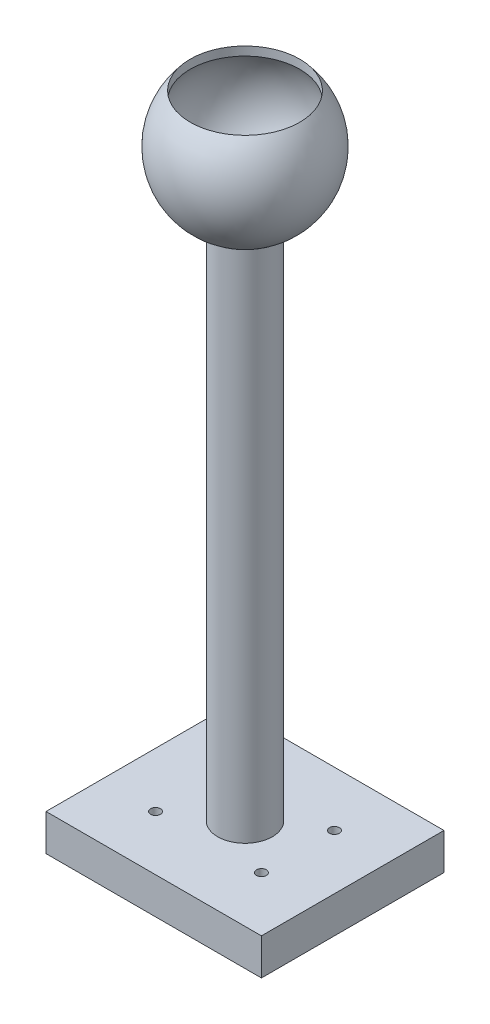
from build123d import *

# Parameters (mm, degrees)
CROQUIS1_W                       = 59
CROQUIS1_H                       = 50
SALIENTE_EXTRUIR1_50X50X24_DEPTH = 24
CROQUIS2_R                       = 7.5
SALIENTE_EXTRUIR2_15MM_DEPTH     = 160
CROQUIS8_R                       = 1.35
EXTRUIR_TORNILLOS_2_7MM_DEPTH    = 25
CROQUIS10_R                      = 15
EXTRUIR_ARRIBA_30_MM_DEPTH       = 29
CORTAR_EXTRUIR1_DEPTH            = 40
CORTAR_EXTRUIR1_DEPTH_BACK       = 40
F_184MM_W                        = 76.670543524
F_184MM_H                        = 14


with BuildPart() as part:
    # Croquis1 → Saliente-Extruir1 50X50X24 (new body)
    with BuildSketch(Plane(origin=(0, 0, 0), x_dir=(1, 0, 0), z_dir=(0, 1, 0))):
        Rectangle(CROQUIS1_W, CROQUIS1_H)
    extrude(amount=SALIENTE_EXTRUIR1_50X50X24_DEPTH)

    # Croquis2 → Saliente-Extruir2 15MM (add)
    with BuildSketch(Plane(origin=(0, 24, 0), x_dir=(1, 0, 0), z_dir=(0, 1, 0))):
        with Locations(Location((0, 0, 0), (0, 0, 270))):
            Circle(CROQUIS2_R)
    extrude(amount=SALIENTE_EXTRUIR2_15MM_DEPTH)

    # Croquis8 → EXTRUIR TORNILLOS 2.7MM (cut)
    with BuildSketch(Plane(origin=(0, 24, 0), x_dir=(1, 0, 0), z_dir=(0, 1, 0))):
        with Locations(Location((-14.5, 10, 0), (0, 0, 270))):
            Circle(CROQUIS8_R)
        with Locations(Location((14.5, 10, 0), (0, 0, 90))):
            Circle(CROQUIS8_R)
        with Locations(Location((14.5, -10, 0), (0, 0, 270))):
            Circle(CROQUIS8_R)
        with Locations(Location((-14.5, -10, 0), (0, 0, 90))):
            Circle(CROQUIS8_R)
    extrude(amount=-EXTRUIR_TORNILLOS_2_7MM_DEPTH, mode=Mode.SUBTRACT)


with BuildPart() as body_2:
    # Croquis3 → Revolución2 40 MM (revolve)
    with BuildSketch(Plane(origin=(0, 184, 0), x_dir=(1, 0, 0), z_dir=(0, 1, 0))):
        with BuildLine():
            Line((0, 20), (0, -20))
            ThreePointArc((0, -20), (20, 0), (0, 20))
        make_face()
    revolve(axis=Axis((0, 184, -20), (0, 0, 1)))


with BuildPart() as extruir_centro_circulo_37_mm_tool:
    # Croquis6 → EXTRUIR CENTRO CIRCULO 37 MM (revolve)
    with BuildSketch(Plane(origin=(0, 184, 0), x_dir=(1, 0, 0), z_dir=(0, 1, 0))):
        with BuildLine():
            Line((0, 18.5), (0, -18.5))
            ThreePointArc((0, -18.5), (18.5, 0), (0, 18.5))
        make_face()
    revolve(axis=Axis((0, 184, -18.5), (0, 0, 1)))


with BuildPart() as part_1:
    add(part.part)

    # EXTRUIR CENTRO CIRCULO 37 MM: cut by extruir_centro_circulo_37_mm_tool
    add(extruir_centro_circulo_37_mm_tool.part, mode=Mode.SUBTRACT)

    # 184MM → Cortar-Extruir1 (cut, two sides: drawn at the far end of the back side and taken through both)
    with BuildSketch(Plane.XY.offset(-CORTAR_EXTRUIR1_DEPTH_BACK)):
        with Locations((0, 7)):
            Rectangle(F_184MM_W, F_184MM_H)
    extrude(amount=CORTAR_EXTRUIR1_DEPTH + CORTAR_EXTRUIR1_DEPTH_BACK, mode=Mode.SUBTRACT)


with BuildPart() as body_2_1:
    add(body_2.part)

    # EXTRUIR CENTRO CIRCULO 37 MM: cut by extruir_centro_circulo_37_mm_tool
    add(extruir_centro_circulo_37_mm_tool.part, mode=Mode.SUBTRACT)

    # Croquis10 → EXTRUIR ARRIBA 30 MM (cut)
    with BuildSketch(Plane(origin=(0, 184, 0), x_dir=(1, 0, 0), z_dir=(0, 1, 0))):
        with Locations(Location((0, 0, 0), (0, 0, 90))):
            Circle(CROQUIS10_R)
    extrude(amount=EXTRUIR_ARRIBA_30_MM_DEPTH, mode=Mode.SUBTRACT)


solid = Compound([part_1.part, body_2_1.part])
